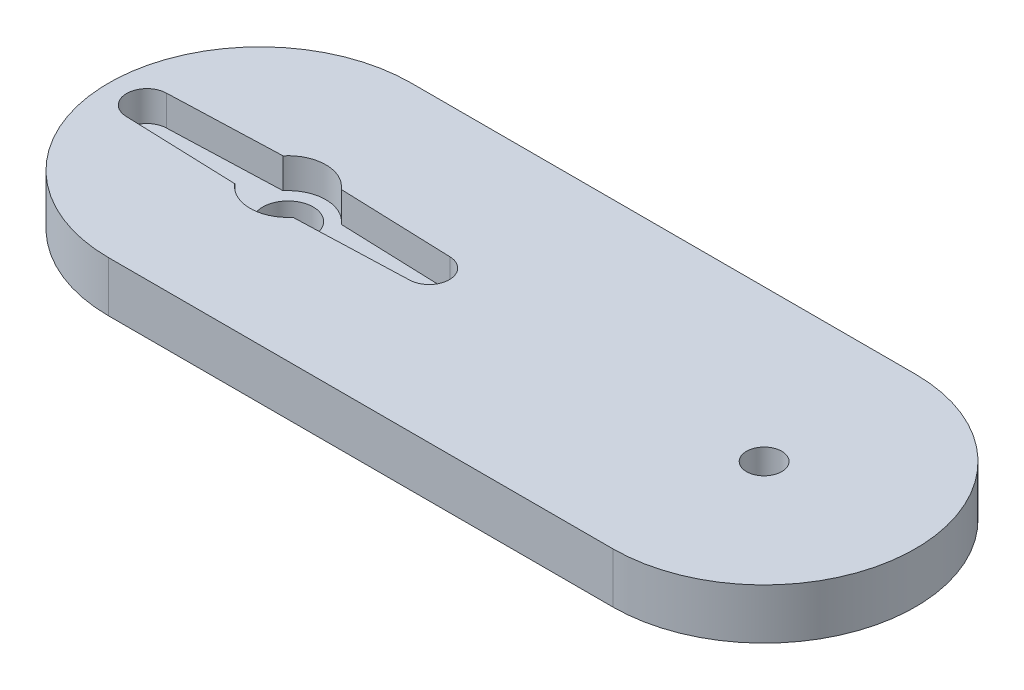
from build123d import *

# Parameters (mm, degrees)
RESSALTO_EXTRUS_O2_DEPTH = 5
ESBO_O4_R                = 1.75
CORTE_EXTRUS_O1_DEPTH    = 10
CORTE_EXTRUS_O2_DEPTH    = 3
ESBO_O7_R                = 2.5
CORTE_EXTRUS_O3_DEPTH    = 67.895440801


with BuildPart() as part:
    # Esboço3 → Ressalto-extrusão2 (new body)
    with BuildSketch(Plane(origin=(0, 0, 0), x_dir=(1, 0, 0), z_dir=(0, 1, 0))):
        with BuildLine():
            Line((-50, 15), (0, 15))
            ThreePointArc((0, 15), (15, 0), (0, -15))
            Line((0, -15), (-50, -15))
            ThreePointArc((-50, -15), (-65, 0), (-50, 15))
        make_face()
    extrude(amount=RESSALTO_EXTRUS_O2_DEPTH)

    # Esboço4 → Corte-extrusão1 (cut)
    with BuildSketch(Plane(origin=(0, 5, 0), x_dir=(1, 0, 0), z_dir=(0, 1, 0))):
        with Locations(Location((0, 0, 0), (0, 0, 90))):
            Circle(ESBO_O4_R)
    extrude(amount=-CORTE_EXTRUS_O1_DEPTH, mode=Mode.SUBTRACT)

    # Esboço6 → Corte-extrusão2 (cut)
    with BuildSketch(Plane(origin=(0, 5, 0), x_dir=(1, 0, 0), z_dir=(0, 1, 0))):
        with BuildLine():
            Line((-50.096108497, 2.395111434), (-61.281465627, 1.998745461))
            ThreePointArc((-61.281465627, 1.998745461), (-63.210637787, 0), (-61.281465627, -1.998745461))
            Line((-61.281465627, -1.998745461), (-50.096108497, -2.395111434))
            ThreePointArc((-50.096108497, -2.395111434), (-47.210637787, -3.75), (-44.325167077, -2.395111434))
            Line((-44.325167077, -2.395111434), (-33.139809947, -1.998745461))
            ThreePointArc((-33.139809947, -1.998745461), (-31.210637787, 0), (-33.139809947, 1.998745461))
            Line((-33.139809947, 1.998745461), (-44.325167077, 2.395111434))
            ThreePointArc((-44.325167077, 2.395111434), (-47.210637787, 3.75), (-50.096108497, 2.395111434))
        make_face()
        with BuildLine():
            ThreePointArc((-47.443873787, 2.489096416), (-47.210637787, 2.5), (-46.977401787, 2.489096416))
            ThreePointArc((-46.977401787, 2.489096416), (-45.362247947, 1.683286963), (-44.710637787, 0))
            ThreePointArc((-44.710637787, 0), (-45.362247947, -1.683286963), (-46.977401787, -2.489096416))
            ThreePointArc((-46.977401787, -2.489096416), (-47.210637787, -2.5), (-47.443873787, -2.489096416))
            ThreePointArc((-47.443873787, -2.489096416), (-49.710637787, 0), (-47.443873787, 2.489096416))
        make_face(mode=Mode.SUBTRACT)
    extrude(amount=-CORTE_EXTRUS_O2_DEPTH, mode=Mode.SUBTRACT)

    # Esboço7 → Corte-extrusão3 (cut, through all)
    with BuildSketch(Plane(origin=(0, 5, 0), x_dir=(1, 0, 0), z_dir=(0, 1, 0))):
        with Locations(Location((-47.210637787, 0, 0), (0, 0, 270))):
            Circle(ESBO_O7_R)
    extrude(amount=-CORTE_EXTRUS_O3_DEPTH, mode=Mode.SUBTRACT)


solid = part.part
